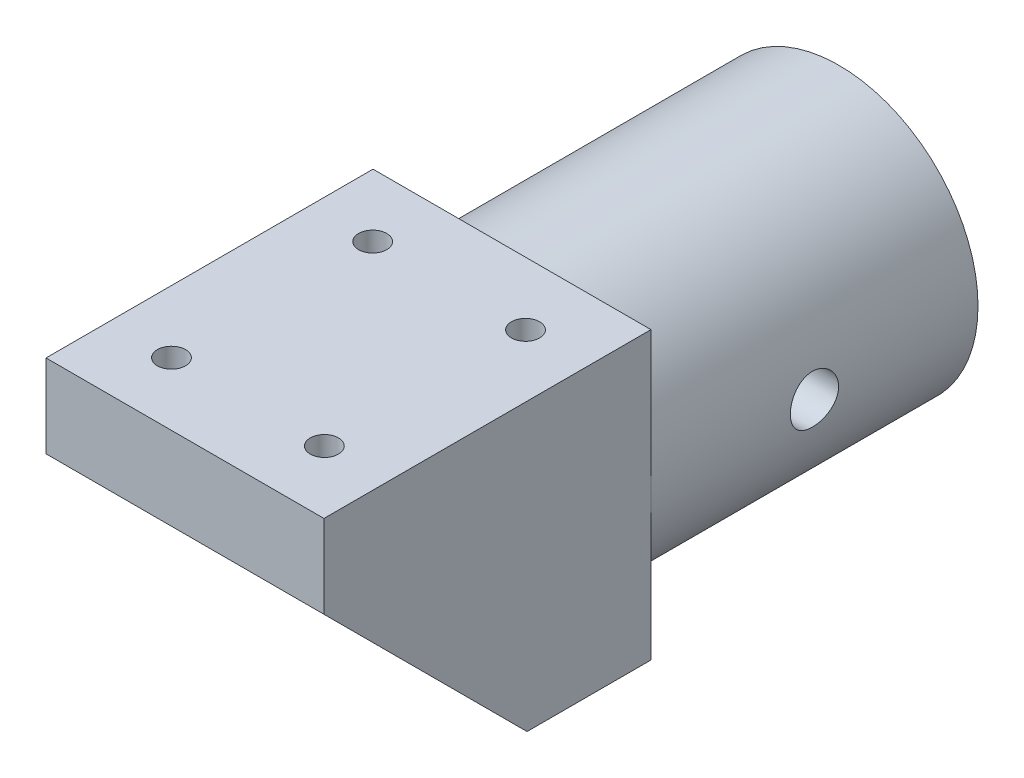
from build123d import *

# Parameters (mm, degrees)
SKETCH1_R                = 17.272
SKETCH1_R_2              = 9.652
BOSS_EXTRUDE1_DEPTH      = 40.64
BOSS_EXTRUDE2_DEPTH      = 17.78
BOSS_EXTRUDE2_DEPTH_BACK = 17.78
SKETCH3_W                = 34.544
SKETCH3_H                = 40.64
CHAMFER1_SIZE            = 25.24
SKETCH5_R                = 1.75
CUT_EXTRUDE2_DEPTH       = 40.64
SKETCH7_R                = 6.35
CUT_EXTRUDE6_DEPTH       = 30.48
CUT_EXTRUDE7_DEPTH       = 30.48
CUT_EXTRUDE7_DEPTH_BACK  = 30.48
SKETCH8_R                = 3


with BuildPart() as part:
    # Sketch1 → Boss-Extrude1 (new body)
    with BuildSketch(Plane.XY):
        Circle(SKETCH1_R)
        Circle(SKETCH1_R_2, mode=Mode.SUBTRACT)
    extrude(amount=BOSS_EXTRUDE1_DEPTH)

    # Sketch3 → Boss-Extrude2 (add, two sides: drawn at the far end of the back side and taken through both)
    with BuildSketch(Plane(origin=(0, 0, 0), x_dir=(1, 0, 0), z_dir=(0, 1, 0)).offset(-BOSS_EXTRUDE2_DEPTH_BACK)):
        with Locations((0, -60.96)):
            Rectangle(SKETCH3_W, SKETCH3_H)
    extrude(amount=BOSS_EXTRUDE2_DEPTH + BOSS_EXTRUDE2_DEPTH_BACK)

    # Chamfer1
    chamfer1_edges = [part.edges().sort_by_distance(p)[0] for p in [
        (0, -17.78, 81.28),
    ]]
    chamfer(chamfer1_edges, length=CHAMFER1_SIZE)

    # Sketch5 → Cut-Extrude2 (cut)
    with BuildSketch(Plane(origin=(0, 17.78, 0), x_dir=(1, 0, 0), z_dir=(0, 1, 0))):
        with Locations(Location((-9.5, -48.46, 0), (0, 0, 270))):
            Circle(SKETCH5_R)
        with Locations(Location((9.5, -48.46, 0), (0, 0, 270))):
            Circle(SKETCH5_R)
        with Locations(Location((9.5, -73.46, 0), (0, 0, 270))):
            Circle(SKETCH5_R)
        with Locations(Location((-9.5, -73.46, 0), (0, 0, 270))):
            Circle(SKETCH5_R)
    extrude(amount=-CUT_EXTRUDE2_DEPTH, mode=Mode.SUBTRACT)

    # Sketch7 → Cut-Extrude6 (cut)
    with BuildSketch(Plane.XZ.offset(17.78)):
        with Locations(Location((-9.5, 73.46, 0), (0, 0, 270))):
            Circle(SKETCH7_R)
        with Locations(Location((9.5, 73.46, 0), (0, 0, 270))):
            Circle(SKETCH7_R)
        with Locations(Location((-9.5, 48.46, 0), (0, 0, 270))):
            Circle(SKETCH7_R)
        with Locations(Location((9.5, 48.46, 0), (0, 0, 270))):
            Circle(SKETCH7_R)
    extrude(amount=-CUT_EXTRUDE6_DEPTH, mode=Mode.SUBTRACT)

    # Sketch8 → Cut-Extrude7 (cut, two sides: drawn at the far end of the back side and taken through both)
    with BuildSketch(Plane(origin=(0, 0, 0), x_dir=(0, 0, -1), z_dir=(1, 0, 0)).offset(-CUT_EXTRUDE7_DEPTH_BACK)):
        with Locations(Location((-20.32, 0, 0), (0, 0, 180))):
            Circle(SKETCH8_R)
    extrude(amount=CUT_EXTRUDE7_DEPTH + CUT_EXTRUDE7_DEPTH_BACK, mode=Mode.SUBTRACT)


solid = part.part
